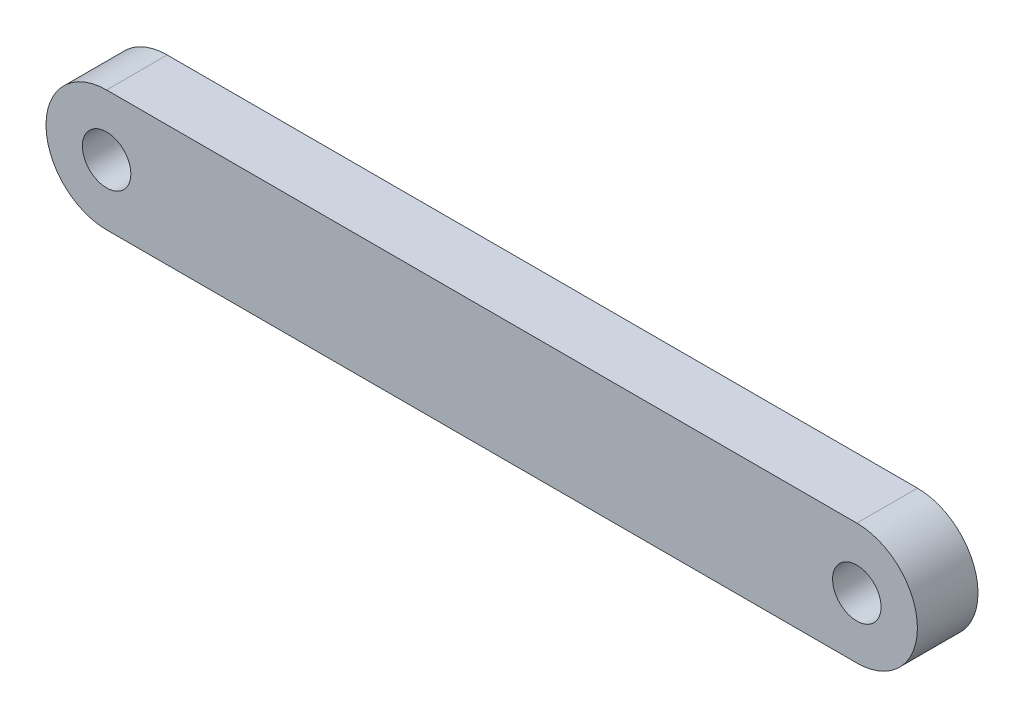
from build123d import *

# Parameters (mm, degrees)
SKETCH_2_R      = 2
EXTRUDE_1_DEPTH = 2.5


with BuildPart() as part:
    # 草圖2 → 填料-伸長1 (new, symmetric)
    with BuildSketch(Plane.XY):
        with BuildLine():
            Line((-30.95, 5), (30.95, 5))
            ThreePointArc((30.95, 5), (35.95, 0), (30.95, -5))
            Line((30.95, -5), (-30.95, -5))
            ThreePointArc((-30.95, -5), (-35.95, 0), (-30.95, 5))
        make_face()
        with Locations((30.95, 0)):
            Circle(SKETCH_2_R, mode=Mode.SUBTRACT)
        with Locations((-30.95, 0)):
            Circle(SKETCH_2_R, mode=Mode.SUBTRACT)
    extrude(amount=EXTRUDE_1_DEPTH, both=True)


solid = part.part
